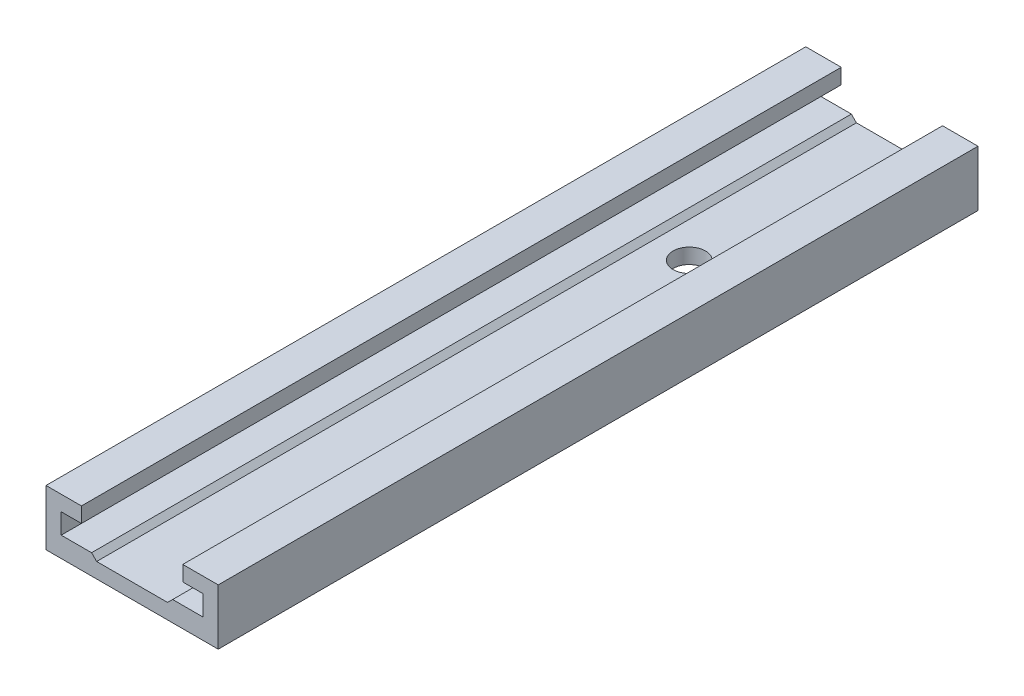
from build123d import *

# Parameters (mm, degrees)
AUFSATZ_LINEAR_AUSTRAGEN1_DEPTH  = 75
F_3_2_3_2_DURCHMESSER_BOHRUNG3_D = 3.2


with BuildPart() as part:
    # Skizze1 → Aufsatz-Linear austragen1 (new body)
    with BuildSketch(Plane.XY):
        Polygon((-8.5, 0), (8.5, 0), (8.5, 5.5), (5, 5.5), (5, 4), (7, 4), (7, 2), (4, 2), (3.5, 1.5), (-3.5, 1.5), (-4, 2), (-7, 2), (-7, 4), (-5, 4), (-5, 5.5), (-8.5, 5.5), align=None)
    extrude(amount=AUFSATZ_LINEAR_AUSTRAGEN1_DEPTH)

    # Ø3.2 (3.2) Durchmesser Bohrung3 (through all)
    with Locations(Plane(origin=(0, 1.5, 0), x_dir=(1, 0, 0), z_dir=(0, 1, 0))):
        with Locations((0, -80), (0, -20), (0, -140)):
            Hole(F_3_2_3_2_DURCHMESSER_BOHRUNG3_D / 2)


solid = part.part
